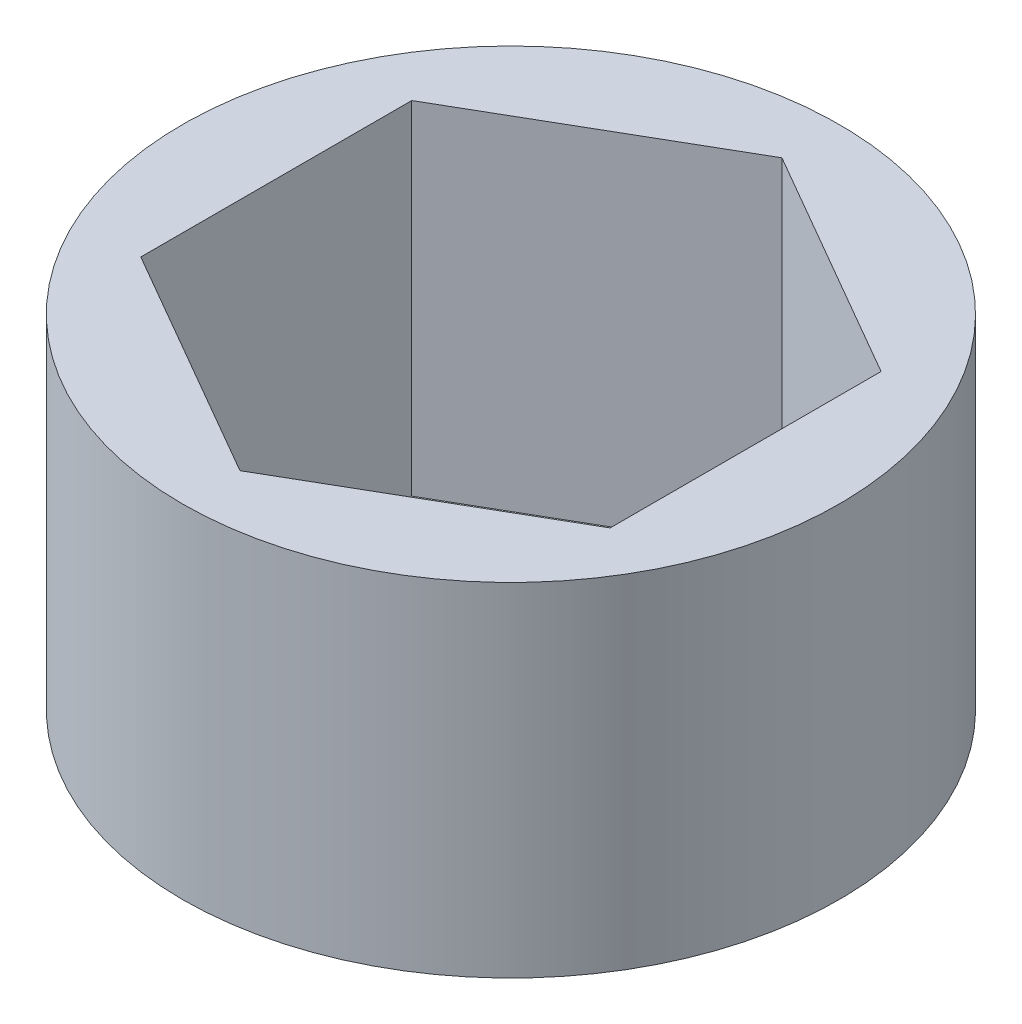
from build123d import *

# Parameters (mm, degrees)
SKETCH1_R           = 8.89
BOSS_EXTRUDE1_DEPTH = 4.6355


with BuildPart() as part:
    # Sketch1 → Boss-Extrude1 (new, symmetric)
    with BuildSketch(Plane(origin=(0, 0, 0), x_dir=(1, 0, 0), z_dir=(0, 1, 0))):
        with Locations(Location((0, 0, 0), (0, 0, 270))):
            Circle(SKETCH1_R)
        Polygon((0, 7.332348419), (-6.35, 3.666174209), (-6.35, -3.666174209), (0, -7.332348419), (6.35, -3.666174209), (6.35, 3.666174209), align=None, mode=Mode.SUBTRACT)
    extrude(amount=BOSS_EXTRUDE1_DEPTH, both=True)


solid = part.part
